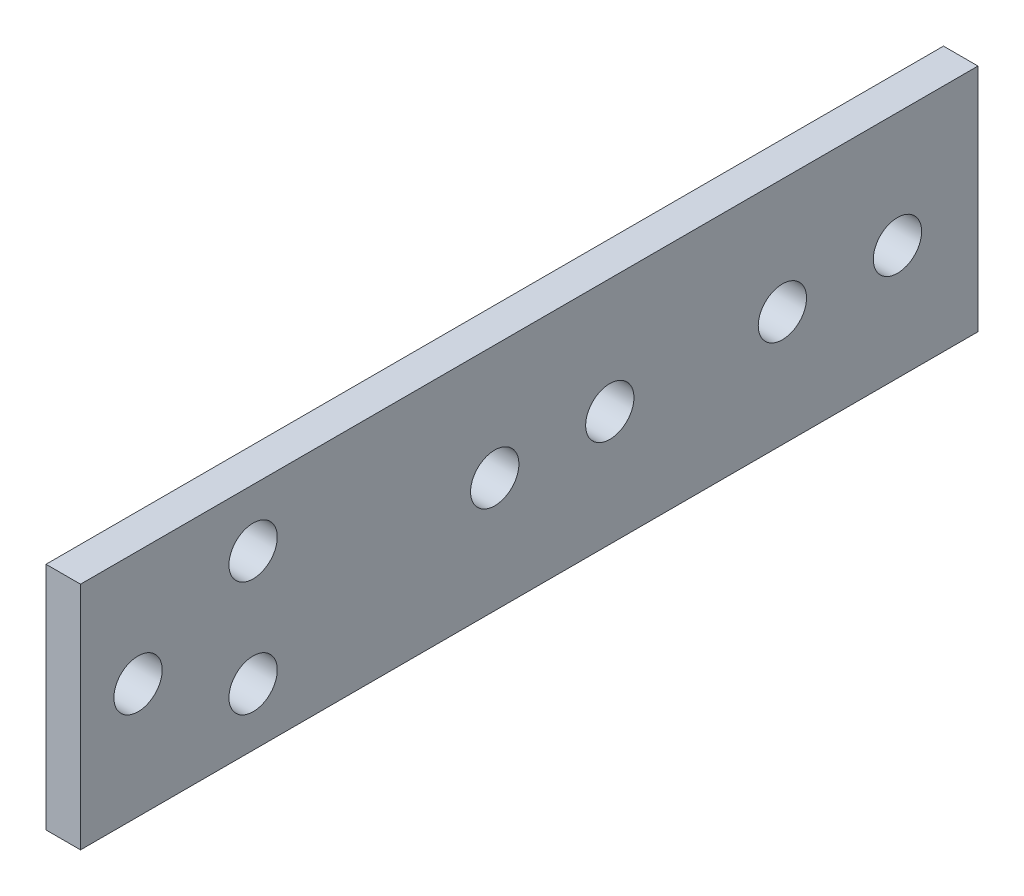
from build123d import *

# Parameters (mm, degrees)
SKETCH_1_W      = 78
SKETCH_1_H      = 20
SKETCH_1_R      = 2.1
EXTRUDE_1_DEPTH = 3


with BuildPart() as part:
    # 草图1 → 凸台-拉伸1 (new body)
    with BuildSketch(Plane(origin=(36, 0, 0), x_dir=(0, 0, -1), z_dir=(1, 0, 0))):
        with Locations((19, -70)):
            Rectangle(SKETCH_1_W, SKETCH_1_H)
        with Locations(Location((-15, -70, 0), (0, 0, 180))):
            Circle(SKETCH_1_R, mode=Mode.SUBTRACT)
        with Locations(Location((41, -70, 0), (0, 0, 180))):
            Circle(SKETCH_1_R, mode=Mode.SUBTRACT)
        with Locations(Location((51, -70, 0), (0, 0, 180))):
            Circle(SKETCH_1_R, mode=Mode.SUBTRACT)
        with Locations(Location((26, -70, 0), (0, 0, 180))):
            Circle(SKETCH_1_R, mode=Mode.SUBTRACT)
        with Locations(Location((16, -70, 0), (0, 0, 180))):
            Circle(SKETCH_1_R, mode=Mode.SUBTRACT)
        with Locations(Location((-5, -65, 0), (0, 0, 180))):
            Circle(SKETCH_1_R, mode=Mode.SUBTRACT)
        with Locations(Location((-5, -75, 0), (0, 0, 180))):
            Circle(SKETCH_1_R, mode=Mode.SUBTRACT)
    extrude(amount=-EXTRUDE_1_DEPTH)


solid = part.part
